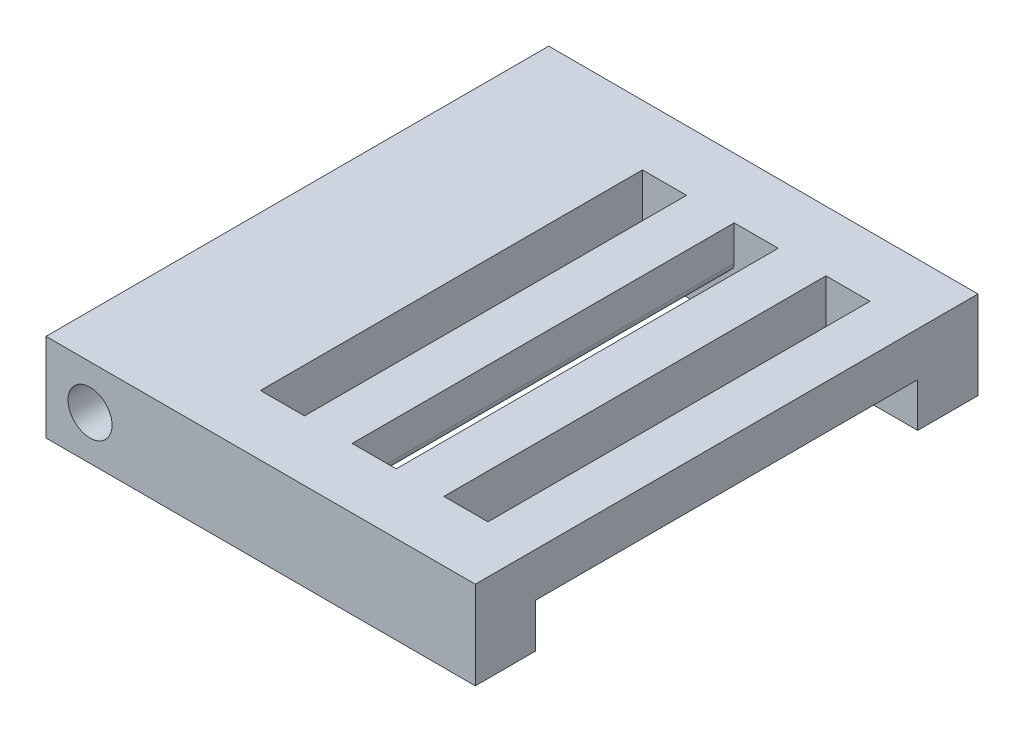
from build123d import *

# Parameters (mm, degrees)
ESQUISSE1_W             = 5
ESQUISSE1_H             = 150
ESQUISSE1_R             = 15
BASE_DEPTH              = 10
VIDE_VIS_DEPTH          = 127.219055614
VIDE_VIS_DEPTH_BACK     = 127.219055614
ESQUISSE5_R             = 2.5
ESQUISSE6_W             = 130
ESQUISSE6_H             = 150
ENL_V_MAT_EXTRU_6_DEPTH = 5
VIDE_TEST_DEPTH         = 118.100384286
ESQUISSE8_W             = 31.25
ESQUISSE8_H             = 6.85
BOSS_FERME_DEPTH        = 10
CONGE_TEST_R            = 1


with BuildPart() as part:
    # Esquisse1 → BASE (new body)
    with BuildSketch(Plane(origin=(0, 0, 0), x_dir=(1, 0, 0), z_dir=(0, 1, 0))):
        Polygon((-82.5, 82.5), (-82.5, 77.5), (-72.5, 77.5), (-72.5, 67.5), (-82.5, 67.5), (-82.5, -2.5), (-72.5, -2.5), (-72.5, -12.5), (-82.5, -12.5), (-82.5, -82.5), (82.5, -82.5), (82.5, -12.5), (72.5, -12.5), (72.5, -2.5), (82.5, -2.5), (82.5, 67.5), (72.5, 67.5), (72.5, 77.5), (82.5, 77.5), (82.5, 82.5), align=None)
        with BuildLine():
            ThreePointArc((-12.916666667, -10.915030923), (-10.627210874, -13.27000839), (-7.916666667, -15.124860621))
            Line((-7.916666667, -15.124860621), (-7.916666667, -75.648107225))
            Line((-7.916666667, -75.648107225), (-12.916666667, -75.648107225))
            Line((-12.916666667, -75.648107225), (-12.916666667, -10.915030923))
        make_face(mode=Mode.SUBTRACT)
        with Locations((-62.5, -0.648107225)):
            Rectangle(ESQUISSE1_W, ESQUISSE1_H, mode=Mode.SUBTRACT)
        with Locations((-52.083333333, -0.648107225)):
            Rectangle(ESQUISSE1_W, ESQUISSE1_H, mode=Mode.SUBTRACT)
        with Locations((-41.666666667, -0.648107225)):
            Rectangle(ESQUISSE1_W, ESQUISSE1_H, mode=Mode.SUBTRACT)
        with Locations((-31.25, -0.648107225)):
            Rectangle(ESQUISSE1_W, ESQUISSE1_H, mode=Mode.SUBTRACT)
        with Locations((-20.833333333, -0.648107225)):
            Rectangle(ESQUISSE1_W, ESQUISSE1_H, mode=Mode.SUBTRACT)
        with Locations(Location((0, -0.648107225, 0), (0, 0, 270))):
            Circle(ESQUISSE1_R, mode=Mode.SUBTRACT)
        with BuildLine():
            Line((-2.5, -75.648107225), (-2.5, -16.957613655))
            ThreePointArc((-2.5, -16.957613655), (0, -17.148107225), (2.5, -16.957613655))
            Line((2.5, -16.957613655), (2.5, -75.648107225))
            Line((2.5, -75.648107225), (-2.5, -75.648107225))
        make_face(mode=Mode.SUBTRACT)
        with BuildLine():
            Line((7.916666667, -75.648107225), (7.916666667, -15.124860621))
            ThreePointArc((7.916666667, -15.124860621), (10.627210874, -13.27000839), (12.916666667, -10.915030923))
            Line((12.916666667, -10.915030923), (12.916666667, -75.648107225))
            Line((12.916666667, -75.648107225), (7.916666667, -75.648107225))
        make_face(mode=Mode.SUBTRACT)
        with BuildLine():
            Line((-12.916666667, 9.618816473), (-12.916666667, 74.351892775))
            Line((-12.916666667, 74.351892775), (-7.916666667, 74.351892775))
            Line((-7.916666667, 74.351892775), (-7.916666667, 13.828646171))
            ThreePointArc((-7.916666667, 13.828646171), (-10.627210874, 11.973793941), (-12.916666667, 9.618816473))
        make_face(mode=Mode.SUBTRACT)
        with Locations((20.833333333, -0.648107225)):
            Rectangle(ESQUISSE1_W, ESQUISSE1_H, mode=Mode.SUBTRACT)
        with Locations((31.25, -0.648107225)):
            Rectangle(ESQUISSE1_W, ESQUISSE1_H, mode=Mode.SUBTRACT)
        with Locations((41.666666667, -0.648107225)):
            Rectangle(ESQUISSE1_W, ESQUISSE1_H, mode=Mode.SUBTRACT)
        with Locations((52.083333333, -0.648107225)):
            Rectangle(ESQUISSE1_W, ESQUISSE1_H, mode=Mode.SUBTRACT)
        with Locations((62.5, -0.648107225)):
            Rectangle(ESQUISSE1_W, ESQUISSE1_H, mode=Mode.SUBTRACT)
        with BuildLine():
            Line((-2.5, 15.661399205), (-2.5, 74.351892775))
            Line((-2.5, 74.351892775), (2.5, 74.351892775))
            Line((2.5, 74.351892775), (2.5, 15.661399205))
            ThreePointArc((2.5, 15.661399205), (0, 15.851892775), (-2.5, 15.661399205))
        make_face(mode=Mode.SUBTRACT)
        with BuildLine():
            Line((12.916666667, 74.351892775), (12.916666667, 9.618816473))
            ThreePointArc((12.916666667, 9.618816473), (10.627210874, 11.973793941), (7.916666667, 13.828646171))
            Line((7.916666667, 13.828646171), (7.916666667, 74.351892775))
            Line((7.916666667, 74.351892775), (12.916666667, 74.351892775))
        make_face(mode=Mode.SUBTRACT)
    extrude(amount=BASE_DEPTH)

    # Esquisse5 → VIDE VIS (cut, two sides: drawn at the far end of the back side and taken through both)
    with BuildSketch(Plane(origin=(0, 0, 12.5), x_dir=(-1, 0, 0), z_dir=(0, 0, -1)).offset(-VIDE_VIS_DEPTH_BACK)):
        with Locations((-77.5, 5)):
            Circle(ESQUISSE5_R)
        with Locations(Location((77.5, 5, 0), (0, 0, 180))):
            Circle(ESQUISSE5_R)
    extrude(amount=VIDE_VIS_DEPTH + VIDE_VIS_DEPTH_BACK, mode=Mode.SUBTRACT)

    # Esquisse6 → Enlèv. mat.-Extru.6 (cut)
    with BuildSketch(Plane.XZ):
        with Locations((0, 0.648107225)):
            Rectangle(ESQUISSE6_W, ESQUISSE6_H)
    extrude(amount=-ENL_V_MAT_EXTRU_6_DEPTH, mode=Mode.SUBTRACT)

    # Esquisse7 → VIDE TEST (cut, through all)
    with BuildSketch(Plane(origin=(0, 10, 0), x_dir=(1, 0, 0), z_dir=(0, 1, 0))):
        Polygon((-33.75, -25.416267648), (-33.75, -82.5), (82.5, -82.5), (82.5, 82.5), (-82.5, 82.5), (-82.5, -25.416267648), align=None)
    extrude(amount=-VIDE_TEST_DEPTH, mode=Mode.SUBTRACT)

    # Esquisse8 → BOSS FERME (add)
    with BuildSketch(Plane.XZ):
        with Locations((-49.375, 28.841267648)):
            Rectangle(ESQUISSE8_W, ESQUISSE8_H)
    extrude(amount=-BOSS_FERME_DEPTH)

    # CONGE TEST
    conge_test_edges = [part.edges().sort_by_distance(p)[0] for p in [
        (-54.583333333, 5, 53.957187436),
        (-49.583333333, 5, 53.957187436),
    ]]
    fillet(conge_test_edges, radius=CONGE_TEST_R)


solid = part.part
